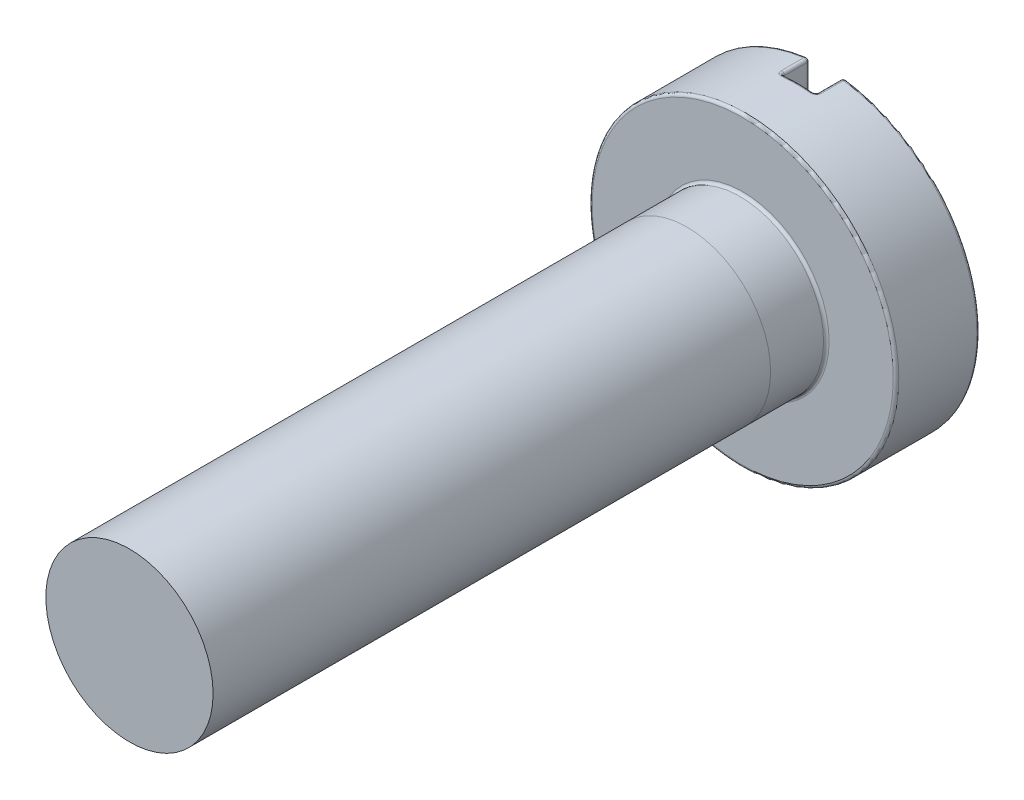
from build123d import *

# Parameters (mm, degrees)
SKETCH1_R           = 1.5
BOSS_EXTRUDE1_DEPTH = 11
SKETCH2_R           = 2.75
BOSS_EXTRUDE2_DEPTH = 1.5
SKETCH3_W           = 0.6
SKETCH3_H           = 13.562630166
CUT_EXTRUDE1_DEPTH  = 0.5
FILLET1_R           = 0.05
FILLET2_R           = 0.05


with BuildPart() as part:
    # Sketch1 → Boss-Extrude1 (new body)
    with BuildSketch(Plane.XY):
        Circle(SKETCH1_R)
    extrude(amount=BOSS_EXTRUDE1_DEPTH)

    # Sketch2 → Boss-Extrude2 (add)
    with BuildSketch(Plane.XY):
        Circle(SKETCH2_R)
    extrude(amount=-BOSS_EXTRUDE2_DEPTH)

    # Sketch3 → Cut-Extrude1 (cut)
    with BuildSketch(Plane(origin=(0, 0, -1.5), x_dir=(-1, 0, 0), z_dir=(0, 0, -1))):
        Rectangle(SKETCH3_W, SKETCH3_H)
    extrude(amount=-CUT_EXTRUDE1_DEPTH, mode=Mode.SUBTRACT)

    # Fillet1
    fillet1_edges = [part.edges().sort_by_distance(p)[0] for p in [
        (2.047864742, -1.835415484, -1.5),
        (-0.3, 0, -1.5),
        (0.3, 0, -1.5),
        (0, 2.75, -1),
        (0, -2.75, -1),
        (0.3, 2.733587387, -1.25),
        (0.3, -2.733587387, -1.25),
        (-0.3, -2.733587387, -1.25),
        (-0.3, 2.733587387, -1.25),
        (0.3, 0, -1),
        (-0.3, 0, -1),
        (-2.75, 0, -1.5),
    ]]
    fillet(fillet1_edges, radius=FILLET1_R)

    # Fillet2
    fillet2_edges = [part.edges().sort_by_distance(p)[0] for p in [
        (-1.5, 0, 0),
        (-2.75, 0, 0),
    ]]
    fillet(fillet2_edges, radius=FILLET2_R)


solid = part.part
